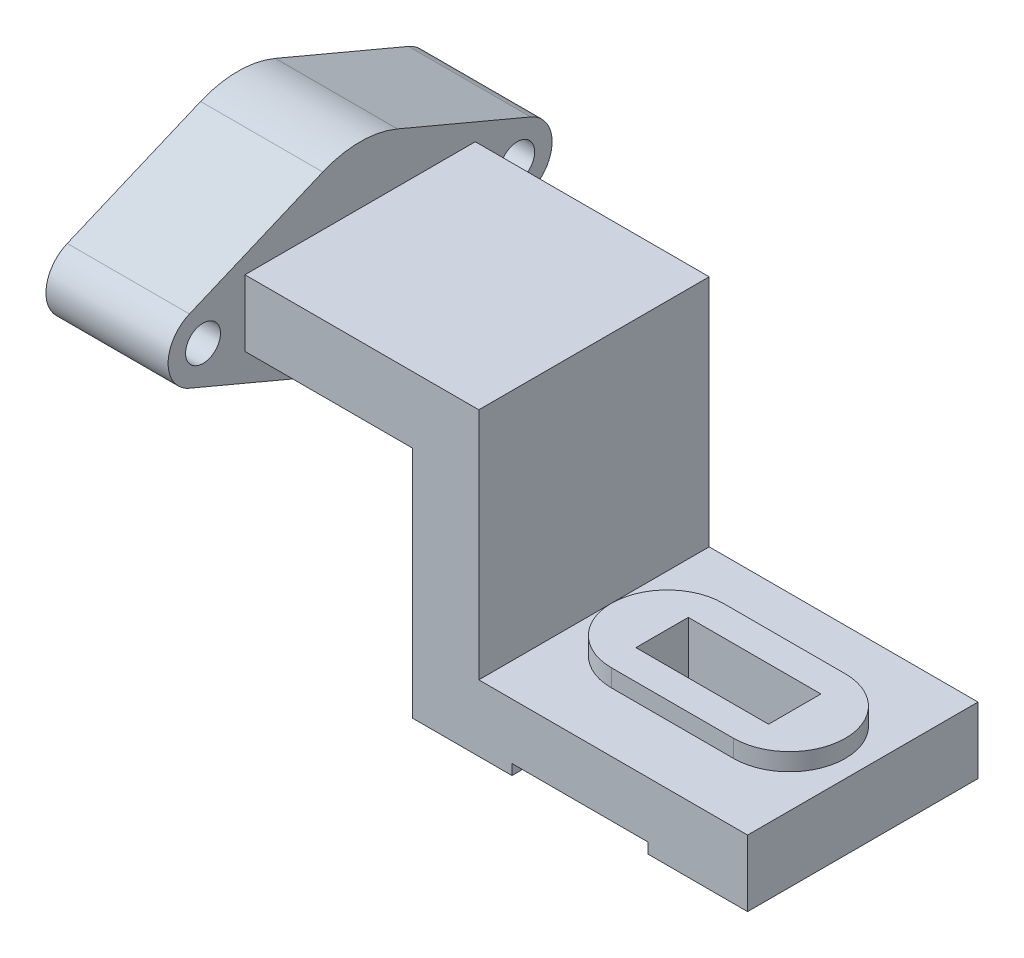
from build123d import *

# Parameters (mm, degrees)
BOSS_EXTRUDE1_DEPTH = 33
BOSS_EXTRUDE2_DEPTH = 5
SKETCH3_W           = 38
SKETCH3_H           = 15
CUT_EXTRUDE1_DEPTH  = 119.949569146
SKETCH4_R           = 5
BOSS_EXTRUDE3_DEPTH = 35
HOLE1_D             = 35
HOLE1_DEPTH         = 34


with BuildPart() as part:
    # Sketch1 → Boss-Extrude1 (new, symmetric)
    with BuildSketch(Plane.XY):
        Polygon((-96, 86), (-29, 86), (-29, 19), (48, 19), (48, 0), (19.5, 0), (19.5, 3), (-19.5, 3), (-19.5, 0), (-48, 0), (-48, 67), (-96, 67), align=None)
    extrude(amount=BOSS_EXTRUDE1_DEPTH, both=True)

    # Sketch2 → Boss-Extrude2 (add)
    with BuildSketch(Plane(origin=(0, 19, 0), x_dir=(1, 0, 0), z_dir=(0, 1, 0))):
        with BuildLine():
            Line((-8, 16), (27, 16))
            ThreePointArc((27, 16), (43, 0), (27, -16))
            Line((27, -16), (-8, -16))
            ThreePointArc((-8, -16), (-24, 0), (-8, 16))
        make_face()
    extrude(amount=BOSS_EXTRUDE2_DEPTH)

    # Sketch3 → Cut-Extrude1 (cut, through all)
    with BuildSketch(Plane(origin=(0, 24, 0), x_dir=(1, 0, 0), z_dir=(0, 1, 0))):
        with Locations((9.5, 0)):
            Rectangle(SKETCH3_W, SKETCH3_H)
    extrude(amount=-CUT_EXTRUDE1_DEPTH, mode=Mode.SUBTRACT)

    # Sketch4 → Boss-Extrude3 (add)
    with BuildSketch(Plane.ZY.offset(96)):
        with BuildLine():
            Line((-48.888888889, 84.21284664), (-10.694444444, 100.33532826))
            ThreePointArc((-10.694444444, 100.33532826), (0, 102.5), (10.694444444, 100.33532826))
            Line((10.694444444, 100.33532826), (48.888888889, 84.21284664))
            ThreePointArc((48.888888889, 84.21284664), (55, 75), (48.888888889, 65.78715336))
            Line((48.888888889, 65.78715336), (10.694444444, 49.66467174))
            ThreePointArc((10.694444444, 49.66467174), (0, 47.5), (-10.694444444, 49.66467174))
            Line((-10.694444444, 49.66467174), (-48.888888889, 65.78715336))
            ThreePointArc((-48.888888889, 65.78715336), (-55, 75), (-48.888888889, 84.21284664))
        make_face()
        with Locations((-45, 75)):
            Circle(SKETCH4_R, mode=Mode.SUBTRACT)
        with Locations((45, 75)):
            Circle(SKETCH4_R, mode=Mode.SUBTRACT)
    extrude(amount=BOSS_EXTRUDE3_DEPTH)

    # Hole1
    with Locations(Plane.ZY.offset(131)):
        with Locations((0, 75)):
            Hole(HOLE1_D / 2, depth=HOLE1_DEPTH)


solid = part.part
